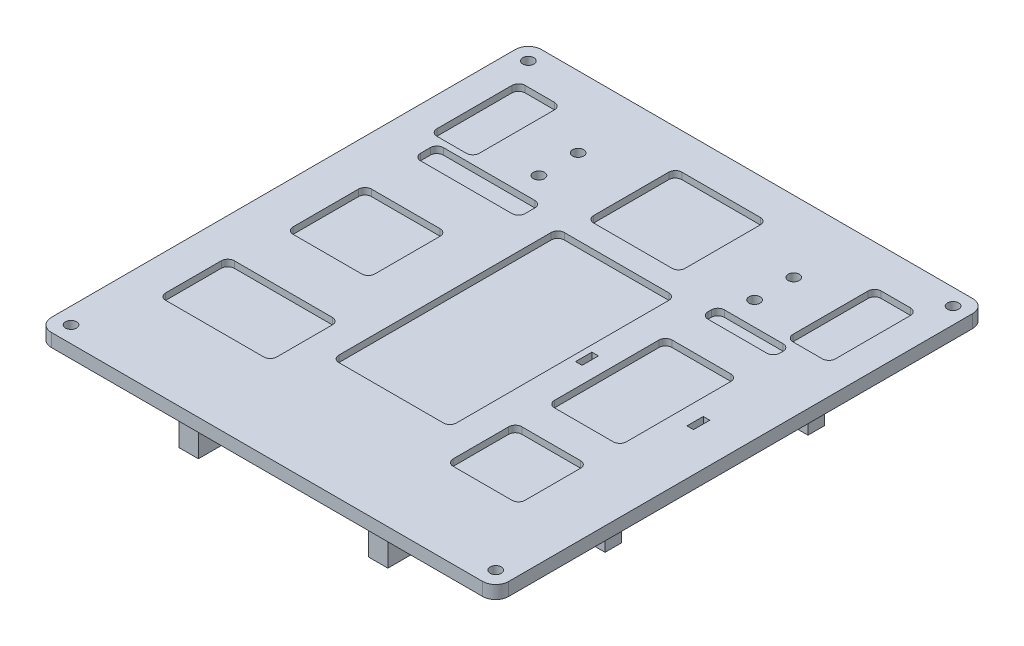
from build123d import *

# Parameters (mm, degrees)
BOSS_EXTRUDE1_DEPTH = 4
CUT_EXTRUDE2_DEPTH  = 2
SKETCH3_W           = 5
SKETCH3_H           = 5
BOSS_EXTRUDE4_DEPTH = 11
SKETCH5_W           = 3
SKETCH5_H           = 2
BOSS_EXTRUDE5_DEPTH = 8
SKETCH6_W           = 2
SKETCH6_H           = 2.5
CUT_EXTRUDE3_DEPTH  = 4
SKETCH7_R           = 3.5
SKETCH7_R_2         = 1.25
BOSS_EXTRUDE6_DEPTH = 6
SKETCH8_R           = 1.7
CUT_EXTRUDE4_DEPTH  = 4
SKETCH9_W           = 6
SKETCH9_H           = 15
SKETCH9_R           = 1
BOSS_EXTRUDE7_DEPTH = 12
SKETCH10_W          = 38
SKETCH10_H          = 6
BOSS_EXTRUDE9_DEPTH = 6
SKETCH11_R          = 1
CUT_EXTRUDE5_DEPTH  = 6


with BuildPart() as part:
    # Sketch1 → Boss-Extrude1 (new body)
    with BuildSketch(Plane(origin=(0, 0, 0), x_dir=(1, 0, 0), z_dir=(0, 1, 0))):
        with BuildLine():
            Line((-66, -75), (66, -75))
            ThreePointArc((66, -75), (68.828427125, -73.828427125), (70, -71))
            Line((70, -71), (70, 71))
            ThreePointArc((70, 71), (68.828427125, 73.828427125), (66, 75))
            Line((66, 75), (-66, 75))
            ThreePointArc((-66, 75), (-68.828427125, 73.828427125), (-70, 71))
            Line((-70, 71), (-70, -71))
            ThreePointArc((-70, -71), (-68.828427125, -73.828427125), (-66, -75))
        make_face()
    extrude(amount=BOSS_EXTRUDE1_DEPTH)

    # Sketch2 → Cut-Extrude2 (cut)
    with BuildSketch(Plane(origin=(0, 4, 0), x_dir=(1, 0, 0), z_dir=(0, 1, 0))):
        with BuildLine():
            Line((-14, -39), (18, -39))
            ThreePointArc((18, -39), (19.414213562, -38.414213562), (20, -37))
            Line((20, -37), (20, 28))
            ThreePointArc((20, 28), (19.414213562, 29.414213562), (18, 30))
            Line((18, 30), (-14, 30))
            ThreePointArc((-14, 30), (-15.414213562, 29.414213562), (-16, 28))
            Line((-16, 28), (-16, -37))
            ThreePointArc((-16, -37), (-15.414213562, -38.414213562), (-14, -39))
        make_face()
        with BuildLine():
            Line((12, 37), (-12, 37))
            ThreePointArc((-12, 37), (-13.414213562, 37.585786438), (-14, 39))
            Line((-14, 39), (-14, 62))
            ThreePointArc((-14, 62), (-13.414213562, 63.414213562), (-12, 64))
            Line((-12, 64), (12, 64))
            ThreePointArc((12, 64), (13.414213562, 63.414213562), (14, 62))
            Line((14, 62), (14, 39))
            ThreePointArc((14, 39), (13.414213562, 37.585786438), (12, 37))
        make_face()
        with BuildLine():
            Line((31, 29), (49, 29))
            ThreePointArc((49, 29), (50.414213562, 29.585786438), (51, 31))
            Line((51, 31), (51, 32))
            ThreePointArc((51, 32), (50.414213562, 33.414213562), (49, 34))
            Line((49, 34), (31, 34))
            ThreePointArc((31, 34), (29.585786438, 33.414213562), (29, 32))
            Line((29, 32), (29, 31))
            ThreePointArc((29, 31), (29.585786438, 29.585786438), (31, 29))
        make_face()
        with BuildLine():
            Line((-55, -12), (-34, -12))
            ThreePointArc((-34, -12), (-32.585786438, -11.414213562), (-32, -10))
            Line((-32, -10), (-32, 10))
            ThreePointArc((-32, 10), (-32.585786438, 11.414213562), (-34, 12))
            Line((-34, 12), (-55, 12))
            ThreePointArc((-55, 12), (-56.414213562, 11.414213562), (-57, 10))
            Line((-57, 10), (-57, -10))
            ThreePointArc((-57, -10), (-56.414213562, -11.414213562), (-55, -12))
        make_face()
        with BuildLine():
            Line((31, -18), (49, -18))
            ThreePointArc((49, -18), (50.414213562, -17.414213562), (51, -16))
            Line((51, -16), (51, 16))
            ThreePointArc((51, 16), (50.414213562, 17.414213562), (49, 18))
            Line((49, 18), (31, 18))
            ThreePointArc((31, 18), (29.585786438, 17.414213562), (29, 16))
            Line((29, 16), (29, -16))
            ThreePointArc((29, -16), (29.585786438, -17.414213562), (31, -18))
        make_face()
        with BuildLine():
            Line((-57, -28), (-27, -28))
            ThreePointArc((-27, -28), (-25.585786438, -28.585786438), (-25, -30))
            Line((-25, -30), (-25, -47))
            ThreePointArc((-25, -47), (-25.585786438, -48.414213562), (-27, -49))
            Line((-27, -49), (-57, -49))
            ThreePointArc((-57, -49), (-58.414213562, -48.414213562), (-59, -47))
            Line((-59, -47), (-59, -30))
            ThreePointArc((-59, -30), (-58.414213562, -28.585786438), (-57, -28))
        make_face()
        with BuildLine():
            Line((31, -49), (49, -49))
            ThreePointArc((49, -49), (50.414213562, -48.414213562), (51, -47))
            Line((51, -47), (51, -30))
            ThreePointArc((51, -30), (50.414213562, -28.585786438), (49, -28))
            Line((49, -28), (31, -28))
            ThreePointArc((31, -28), (29.585786438, -28.585786438), (29, -30))
            Line((29, -30), (29, -47))
            ThreePointArc((29, -47), (29.585786438, -48.414213562), (31, -49))
        make_face()
        with BuildLine():
            Line((-59, 36), (-50, 36))
            ThreePointArc((-50, 36), (-48.585786438, 36.585786438), (-48, 38))
            Line((-48, 38), (-48, 61))
            ThreePointArc((-48, 61), (-48.585786438, 62.414213562), (-50, 63))
            Line((-50, 63), (-59, 63))
            ThreePointArc((-59, 63), (-60.414213562, 62.414213562), (-61, 61))
            Line((-61, 61), (-61, 38))
            ThreePointArc((-61, 38), (-60.414213562, 36.585786438), (-59, 36))
        make_face()
        with BuildLine():
            Line((50, 36), (59, 36))
            ThreePointArc((59, 36), (60.414213562, 36.585786438), (61, 38))
            Line((61, 38), (61, 61))
            ThreePointArc((61, 61), (60.414213562, 62.414213562), (59, 63))
            Line((59, 63), (50, 63))
            ThreePointArc((50, 63), (48.585786438, 62.414213562), (48, 61))
            Line((48, 61), (48, 38))
            ThreePointArc((48, 38), (48.585786438, 36.585786438), (50, 36))
        make_face()
        with BuildLine():
            Line((-55, 27), (-27, 27))
            ThreePointArc((-27, 27), (-25.585786438, 27.585786438), (-25, 29))
            Line((-25, 29), (-25, 32))
            ThreePointArc((-25, 32), (-25.585786438, 33.414213562), (-27, 34))
            Line((-27, 34), (-55, 34))
            ThreePointArc((-55, 34), (-56.414213562, 33.414213562), (-57, 32))
            Line((-57, 32), (-57, 29))
            ThreePointArc((-57, 29), (-56.414213562, 27.585786438), (-55, 27))
        make_face()
    extrude(amount=-CUT_EXTRUDE2_DEPTH, mode=Mode.SUBTRACT)

    # Sketch3 → Boss-Extrude4 (add)
    with BuildSketch(Plane.XZ):
        with Locations((20.45, 31.05)):
            Rectangle(SKETCH3_W, SKETCH3_H)
        with Locations((20.45, -31.05)):
            Rectangle(SKETCH3_W, SKETCH3_H)
        with Locations((59.55, -31.05)):
            Rectangle(SKETCH3_W, SKETCH3_H)
        with Locations((59.55, 31.05)):
            Rectangle(SKETCH3_W, SKETCH3_H)
    extrude(amount=BOSS_EXTRUDE4_DEPTH)

    # Sketch5 → Boss-Extrude5 (add)
    with BuildSketch(Plane.XZ):
        with Locations((32, 24)):
            Rectangle(SKETCH5_W, SKETCH5_H)
        with Locations((48, 24)):
            Rectangle(SKETCH5_W, SKETCH5_H)
        with Locations((48, -24)):
            Rectangle(SKETCH5_W, SKETCH5_H)
        with Locations((32, -24)):
            Rectangle(SKETCH5_W, SKETCH5_H)
    extrude(amount=BOSS_EXTRUDE5_DEPTH)

    # Sketch6 → Cut-Extrude3 (cut)
    with BuildSketch(Plane.XZ):
        with Locations((22.95, -1.25)):
            Rectangle(SKETCH6_W, SKETCH6_H)
        with Locations((22.95, 1.25)):
            Rectangle(SKETCH6_W, SKETCH6_H)
        with Locations((57.05, 1.25)):
            Rectangle(SKETCH6_W, SKETCH6_H)
        with Locations((57.05, -1.25)):
            Rectangle(SKETCH6_W, SKETCH6_H)
    extrude(amount=-CUT_EXTRUDE3_DEPTH, mode=Mode.SUBTRACT)

    # Sketch7 → Boss-Extrude6 (add)
    # profile 1 of 4: a face of its own
    with BuildSketch(Plane.XZ):
        with Locations(Location((-63.75, 18.75, 0), (0, 0, 270))):
            Circle(SKETCH7_R)
        with Locations(Location((-63.75, 18.75, 0), (0, 0, 270))):
            Circle(SKETCH7_R_2, mode=Mode.SUBTRACT)
    # profile 2 of 4: a face of its own
    with BuildSketch(Plane.XZ):
        with Locations(Location((-63.75, -18.75, 0), (0, 0, 270))):
            Circle(SKETCH7_R)
        with Locations(Location((-63.75, -18.75, 0), (0, 0, 270))):
            Circle(SKETCH7_R_2, mode=Mode.SUBTRACT)
    # profile 3 of 4: a face of its own
    with BuildSketch(Plane.XZ):
        with Locations(Location((-26.25, -18.75, 0), (0, 0, 270))):
            Circle(SKETCH7_R)
        with Locations(Location((-26.25, -18.75, 0), (0, 0, 270))):
            Circle(SKETCH7_R_2, mode=Mode.SUBTRACT)
    # profile 4 of 4: a face of its own
    with BuildSketch(Plane.XZ):
        with Locations(Location((-26.25, 18.75, 0), (0, 0, 270))):
            Circle(SKETCH7_R)
        with Locations(Location((-26.25, 18.75, 0), (0, 0, 270))):
            Circle(SKETCH7_R_2, mode=Mode.SUBTRACT)
    extrude(amount=BOSS_EXTRUDE6_DEPTH)

    # Sketch8 → Cut-Extrude4 (cut)
    with BuildSketch(Plane.XZ):
        with Locations(Location((-64.984975036, 70.000927767, 0), (0, 0, 270))):
            Circle(SKETCH8_R)
        with Locations(Location((65.015024964, 70.000927767, 0), (0, 0, 90))):
            Circle(SKETCH8_R)
        with Locations(Location((65.015024964, -69.999072233, 0), (0, 0, 270))):
            Circle(SKETCH8_R)
        with Locations(Location((-64.984975036, -69.999072233, 0), (0, 0, 90))):
            Circle(SKETCH8_R)
        with Locations(Location((-32.984975036, -53.226978691, 0), (0, 0, 270))):
            Circle(SKETCH8_R)
        with Locations(Location((-32.984975036, -41.226978691, 0), (0, 0, 270))):
            Circle(SKETCH8_R)
        with Locations(Location((33.015024964, -41.226978691, 0), (0, 0, 90))):
            Circle(SKETCH8_R)
        with Locations(Location((33.015024964, -53.226978691, 0), (0, 0, 90))):
            Circle(SKETCH8_R)
    extrude(amount=-CUT_EXTRUDE4_DEPTH, mode=Mode.SUBTRACT)

    # Sketch9 → Boss-Extrude7 (add)
    # profile 1 of 2: a face of its own
    with BuildSketch(Plane.XZ):
        with Locations((-29, 62.5)):
            Rectangle(SKETCH9_W, SKETCH9_H)
        with Locations(Location((-29, 62.5, 0), (0, 0, 270))):
            Circle(SKETCH9_R, mode=Mode.SUBTRACT)
    # profile 2 of 2: a face of its own
    with BuildSketch(Plane.XZ):
        with Locations((29, 62.5)):
            Rectangle(SKETCH9_W, SKETCH9_H)
        with Locations(Location((29, 62.5, 0), (0, 0, 270))):
            Circle(SKETCH9_R, mode=Mode.SUBTRACT)
    extrude(amount=BOSS_EXTRUDE7_DEPTH)

    # Sketch10 → Boss-Extrude9 (add)
    with BuildSketch(Plane.XZ):
        with Locations((0, 45)):
            Rectangle(SKETCH10_W, SKETCH10_H)
    extrude(amount=BOSS_EXTRUDE9_DEPTH)

    # Sketch11 → Cut-Extrude5 (cut)
    with BuildSketch(Plane(origin=(0, 0, 42), x_dir=(-1, 0, 0), z_dir=(0, 0, -1))):
        with Locations((15, -3)):
            Circle(SKETCH11_R)
        with Locations((-15, -3)):
            Circle(SKETCH11_R)
    extrude(amount=-CUT_EXTRUDE5_DEPTH, mode=Mode.SUBTRACT)


solid = part.part
